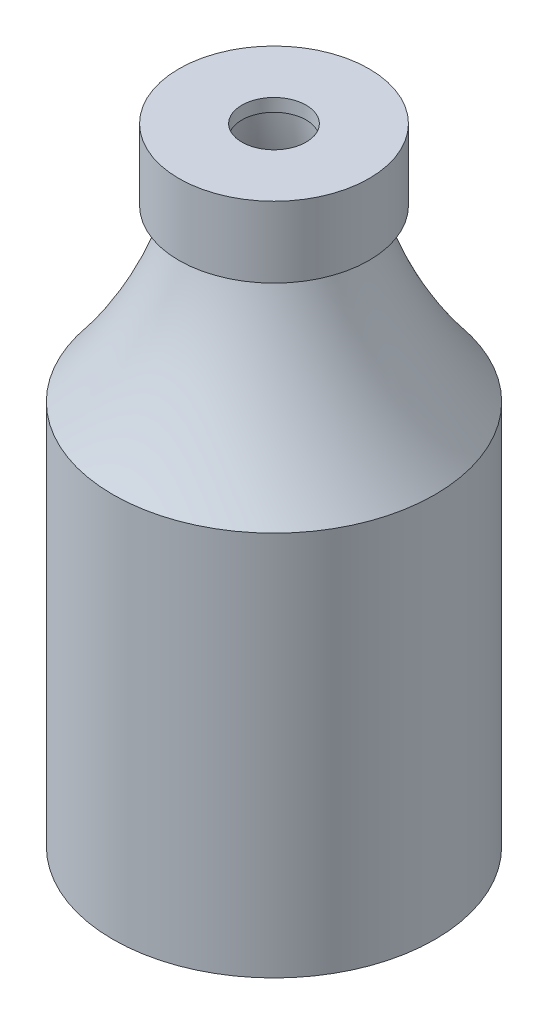
from build123d import *

# Parameters (mm, degrees)
SKETCH4_R          = 12.7
CUT_EXTRUDE1_DEPTH = 50.8


with BuildPart() as part:
    # Sketch2 → Revolve1 (revolve)
    with BuildSketch(Plane.XY):
        with BuildLine():
            Line((-11.947688608, 77.056557333), (-11.947688608, -170.628560352))
            Line((-11.947688608, -170.628560352), (-75.638147441, -170.628560352))
            Line((-75.638147441, -170.628560352), (-75.638147441, -18.228560352))
            add(Edge.make_bspline(
                [(-75.638147441, -18.228560352), (-41.40779095, 25.603897983), (-37.347688608, 77.056557333)],
                knots=[0, 0, 0, 1, 1, 1], degree=2))
            Line((-37.347688608, 77.056557333), (-11.947688608, 77.056557333))
        make_face()
    revolve(axis=Axis((-11.947688608, 77.056557333, 0), (0, -1, 0)))

    # Sketch3 → Revolve2 (revolve)
    with BuildSketch(Plane.XY, mode=Mode.PRIVATE) as revolve2_sk:
        with BuildLine():
            Line((-49.56693434, 48.997587312), (-41.94693434, 48.997587312))
            add(Edge.make_bspline(
                [(-37.347688606, 77.05655735), (-38.47805175, 62.73174853), (-41.946934336, 48.997587311)],
                knots=[0, 0, 0, 0.27840755, 0.27840755, 0.27840755], degree=2))
            Line((-37.347688606, 77.05655735), (-49.56693434, 77.05655735))
            Line((-49.56693434, 77.05655735), (-49.56693434, 48.997587312))
        make_face()
    revolve(revolve2_sk.sketch.rotate(Axis((-11.947688608, -170.628560352, 0), (0, 1, 0)), 180), axis=Axis((-11.947688608, -170.628560352, 0), (0, 1, 0)))

    # Sketch4 → Cut-Extrude1 (cut)
    with BuildSketch(Plane(origin=(0, 77.056557333, 0), x_dir=(1, 0, 0), z_dir=(0, 1, 0))):
        with Locations(Location((-11.947688608, 0, 0), (0, 0, 180))):
            Circle(SKETCH4_R)
    extrude(amount=-CUT_EXTRUDE1_DEPTH, mode=Mode.SUBTRACT)

    # Sketch5 → Cut-Revolve1 (revolve, cut)
    with BuildSketch(Plane.XY, mode=Mode.PRIVATE) as cut_revolve1_sk:
        with BuildLine():
            Line((-17.027688608, -165.548560352), (-17.027688608, 71.976557333))
            Line((-17.027688608, 71.976557333), (-32.715004421, 71.976557333))
            add(Edge.make_bspline(
                [(-32.715004421, 71.976557333), (-34.491548465, 55.152406634), (-38.639010582, 39.007317693), (-45.89970512, 21.587276989), (-46.742513348, 19.662046222), (-48.500048501, 15.832183135), (-49.416278966, 13.924686931), (-52.256576763, 8.26403653), (-54.274096029, 4.567347719), (-60.67628191, -6.3053686), (-65.409969255, -13.264423559), (-70.558147441, -19.965805759)],
                knots=[0, 0, 0, 0, 0.5, 0.5, 0.5625, 0.5625, 0.625, 0.625, 0.75, 0.75, 1, 1, 1, 1], degree=3))
            Line((-70.558147441, -19.965805759), (-70.558147441, -165.548560352))
            Line((-70.558147441, -165.548560352), (-17.027688608, -165.548560352))
        make_face()
    revolve(cut_revolve1_sk.sketch.rotate(Axis((-17.027688608, -165.548560352, 0), (0, 1, 0)), 180), axis=Axis((-17.027688608, -165.548560352, 0), (0, 1, 0)), mode=Mode.SUBTRACT)


solid = part.part
